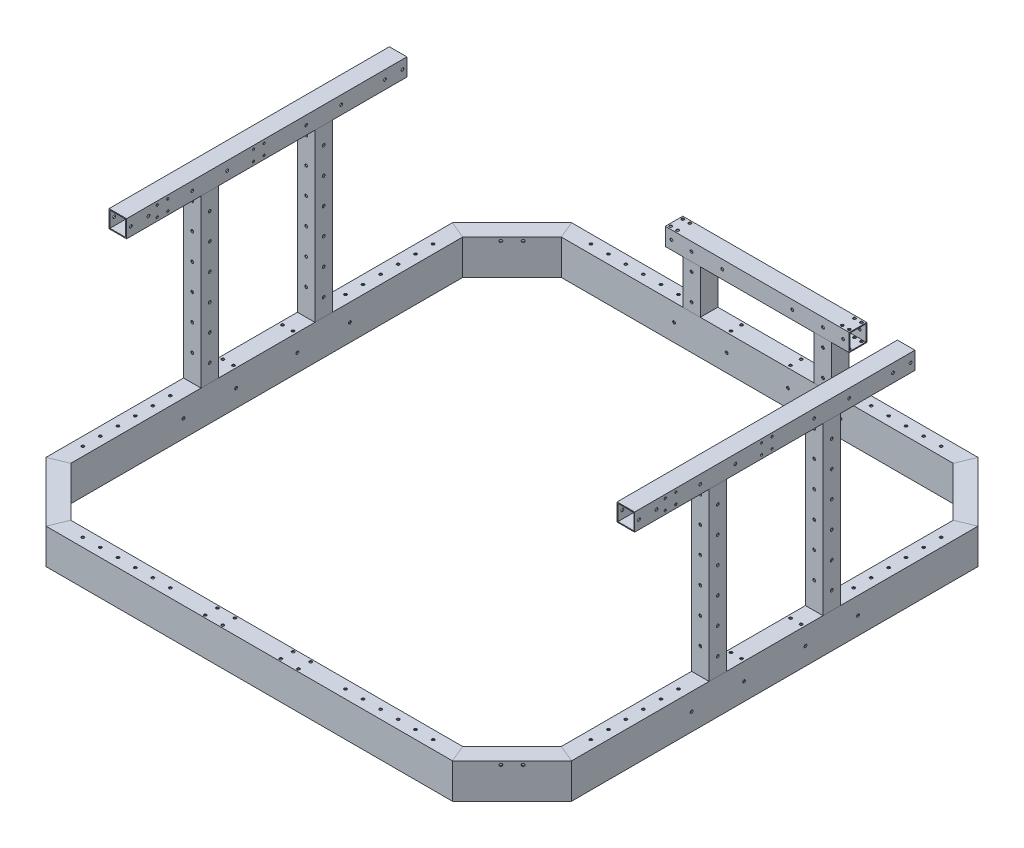
from build123d import *

# Parameters (mm, degrees)
F_20_X_20_X_2_1_DEPTH      = 465.977825579
F_20_X_20_X_2_1_DEPTH_BACK = 10.262096827
SKETCH1_W                  = 20
SKETCH1_H                  = 40
SKETCH1_W_2                = 18
SKETCH1_H_2                = 38
SKETCH1_ON_SEGMENT_2_W     = 20
SKETCH1_ON_SEGMENT_2_H     = 40
SKETCH1_ON_SEGMENT_2_W_2   = 18
SKETCH1_ON_SEGMENT_2_H_2   = 38
F_20_X_20_X_2_1_2_DEPTH    = 108.406444647
SKETCH1_ON_SEGMENT_3_W     = 20
SKETCH1_ON_SEGMENT_3_H     = 40
SKETCH1_ON_SEGMENT_3_W_2   = 18
SKETCH1_ON_SEGMENT_3_H_2   = 38
F_20_X_20_X_2_1_3_DEPTH    = 476.239922406
SKETCH1_ON_SEGMENT_4_W     = 20
SKETCH1_ON_SEGMENT_4_H     = 40
SKETCH1_ON_SEGMENT_4_W_2   = 18
SKETCH1_ON_SEGMENT_4_H_2   = 38
F_20_X_20_X_2_1_4_DEPTH    = 108.406444647
SKETCH1_ON_SEGMENT_5_W     = 20
SKETCH1_ON_SEGMENT_5_H     = 40
SKETCH1_ON_SEGMENT_5_W_2   = 18
SKETCH1_ON_SEGMENT_5_H_2   = 38
F_20_X_20_X_2_1_5_DEPTH    = 476.239922406
SKETCH1_ON_SEGMENT_6_W     = 20
SKETCH1_ON_SEGMENT_6_H     = 40
SKETCH1_ON_SEGMENT_6_W_2   = 18
SKETCH1_ON_SEGMENT_6_H_2   = 38
F_20_X_20_X_2_1_6_DEPTH    = 108.406444647
SKETCH1_ON_SEGMENT_7_W     = 20
SKETCH1_ON_SEGMENT_7_H     = 40
SKETCH1_ON_SEGMENT_7_W_2   = 18
SKETCH1_ON_SEGMENT_7_H_2   = 38
F_20_X_20_X_2_1_7_DEPTH    = 476.239922406
SKETCH1_ON_SEGMENT_8_W     = 20
SKETCH1_ON_SEGMENT_8_H     = 40
SKETCH1_ON_SEGMENT_8_W_2   = 18
SKETCH1_ON_SEGMENT_8_H_2   = 38
F_20_X_20_X_2_1_8_DEPTH    = 108.406444647
SKETCH_2_R                 = 1.6
CUT_EXTRUDE_1_DEPTH        = 427.145515059
SKETCH13_W                 = 20
SKETCH13_H                 = 20
SKETCH13_W_2               = 18
SKETCH13_H_2               = 18
F_20_X_20_X_2_4_DEPTH      = 61
SKETCH13_ON_SEGMENT_2_W    = 20
SKETCH13_ON_SEGMENT_2_H    = 20
SKETCH13_ON_SEGMENT_2_W_2  = 18
SKETCH13_ON_SEGMENT_2_H_2  = 18
F_20_X_20_X_2_4_2_DEPTH    = 61
SKETCH13_ON_SEGMENT_3_W    = 20
SKETCH13_ON_SEGMENT_3_H    = 20
SKETCH13_ON_SEGMENT_3_W_2  = 18
SKETCH13_ON_SEGMENT_3_H_2  = 18
F_20_X_20_X_2_4_3_DEPTH    = 210
CUT_EXTRUDE_3467_REACH     = 440.292
SKETCH_11_R                = 1.6
SKETCH15_W                 = 20
SKETCH15_H                 = 20
SKETCH15_W_2               = 18
SKETCH15_H_2               = 18
F_20_X_20_X_2_5_DEPTH      = 201
SKETCH15_ON_SEGMENT_2_W    = 20
SKETCH15_ON_SEGMENT_2_H    = 20
SKETCH15_ON_SEGMENT_2_W_2  = 18
SKETCH15_ON_SEGMENT_2_H_2  = 18
F_20_X_20_X_2_5_2_DEPTH    = 201
SKETCH15_ON_SEGMENT_3_W    = 20
SKETCH15_ON_SEGMENT_3_H    = 20
SKETCH15_ON_SEGMENT_3_W_2  = 18
SKETCH15_ON_SEGMENT_3_H_2  = 18
F_20_X_20_X_2_5_3_DEPTH    = 320
SKETCH_15_R                = 1.25
CUT_EXTRUDE_4769_DEPTH     = 710.154426065
SKETCH_16_R                = 1.6
CUT_EXTRUDE_5362_DEPTH     = 710.154426065
SKETCH_17_R                = 1.6
CUT_EXTRUDE_5799_DEPTH     = 710.154426065
SKETCH_19_R                = 1.6
CUT_EXTRUDE_1_2_DEPTH      = 710.154426065
SKETCH_20_R                = 1.6
CUT_EXTRUDE_2_DEPTH        = 533.470656474
SKETCH_21_R                = 1.6
CUT_EXTRUDE_7568_DEPTH     = 474.392015147
SKETCH_22_R                = 1.6
CUT_EXTRUDE_1_3_DEPTH      = 833.833716903
SKETCH_23_R                = 1.6
CUT_EXTRUDE_2_2_DEPTH      = 833.833716903
SKETCH_24_R                = 1.6
CUT_EXTRUDE_2_3_DEPTH      = 710.154426065
CUT_EXTRUDE_3_REACH        = 711.154
SKETCH_25_R                = 1.6
SKETCH_26_R                = 1.6
CUT_EXTRUDE_4_DEPTH        = 474.392015147
SKETCH_30_R                = 2.5
CUT_EXTRUDE_5_DEPTH        = 1


with BuildPart() as part:
    # Sketch1 → 方形管 20 X 20 X 2(1) (new, two sides: drawn at the far end of the back side and taken through both)
    with BuildSketch(Plane(origin=(-290, 0, 227.857864376), x_dir=(-1, 0, 0), z_dir=(0, 0, -1)).offset(-F_20_X_20_X_2_1_DEPTH_BACK)):
        Rectangle(SKETCH1_W, SKETCH1_H)
        Rectangle(SKETCH1_W_2, SKETCH1_H_2, mode=Mode.SUBTRACT)
    extrude(amount=F_20_X_20_X_2_1_DEPTH + F_20_X_20_X_2_1_DEPTH_BACK)

    # 方形管 20 X 20 X 2(1) mitre 1
    split(bisect_by=Plane(origin=(-290, 0, 227.857864376), x_dir=(0, 1, 0), z_dir=(-0.382683432, 0, -0.923879533)), keep=Keep.TOP)

    # 方形管 20 X 20 X 2(1) mitre 2
    split(bisect_by=Plane(origin=(-290, 0, -227.857864376), x_dir=(0, -1, 0), z_dir=(-0.382683432, 0, 0.923879533)), keep=Keep.TOP)


with BuildPart() as body_2:
    # Sketch1 on segment 2 (carried to segment 2) → 20 X 20 X 2_1 2 (new body)
    with BuildSketch(Plane(origin=(-297.256398255, 0, -220.601466121), x_dir=(-0.707106781, 0, -0.707106781), z_dir=(0.707106781, 0, -0.707106781))):
        Rectangle(SKETCH1_ON_SEGMENT_2_W, SKETCH1_ON_SEGMENT_2_H)
        Rectangle(SKETCH1_ON_SEGMENT_2_W_2, SKETCH1_ON_SEGMENT_2_H_2, mode=Mode.SUBTRACT)
    extrude(amount=F_20_X_20_X_2_1_2_DEPTH)

    # 20 X 20 X 2_1 2 mitre 1
    split(bisect_by=Plane(origin=(-227.857864376, 0, -290), x_dir=(0, -1, 0), z_dir=(-0.923879533, 0, 0.382683432)), keep=Keep.TOP)

    # 20 X 20 X 2_1 2 mitre 2
    split(bisect_by=Plane(origin=(-290, 0, -227.857864376), x_dir=(0, 1, 0), z_dir=(0.382683432, 0, -0.923879533)), keep=Keep.TOP)


with BuildPart() as body_3:
    # Sketch1 on segment 3 (carried to segment 3) → 20 X 20 X 2_1 3 (new body)
    with BuildSketch(Plane(origin=(-238.119961203, 0, -290), x_dir=(0, 0, -1), z_dir=(1, 0, 0))):
        Rectangle(SKETCH1_ON_SEGMENT_3_W, SKETCH1_ON_SEGMENT_3_H)
        Rectangle(SKETCH1_ON_SEGMENT_3_W_2, SKETCH1_ON_SEGMENT_3_H_2, mode=Mode.SUBTRACT)
    extrude(amount=F_20_X_20_X_2_1_3_DEPTH)

    # 20 X 20 X 2_1 3 mitre 1
    split(bisect_by=Plane(origin=(227.857864376, 0, -290), x_dir=(0, -1, 0), z_dir=(-0.923879533, 0, -0.382683432)), keep=Keep.TOP)

    # 20 X 20 X 2_1 3 mitre 2
    split(bisect_by=Plane(origin=(-227.857864376, 0, -290), x_dir=(0, 1, 0), z_dir=(0.923879533, 0, -0.382683432)), keep=Keep.TOP)


with BuildPart() as body_4:
    # Sketch1 on segment 4 (carried to segment 4) → 20 X 20 X 2_1 4 (new body)
    with BuildSketch(Plane(origin=(220.601466121, 0, -297.256398255), x_dir=(0.707106781, 0, -0.707106781), z_dir=(0.707106781, 0, 0.707106781))):
        Rectangle(SKETCH1_ON_SEGMENT_4_W, SKETCH1_ON_SEGMENT_4_H)
        Rectangle(SKETCH1_ON_SEGMENT_4_W_2, SKETCH1_ON_SEGMENT_4_H_2, mode=Mode.SUBTRACT)
    extrude(amount=F_20_X_20_X_2_1_4_DEPTH)

    # 20 X 20 X 2_1 4 mitre 1
    split(bisect_by=Plane(origin=(227.857864376, 0, -290), x_dir=(0, 1, 0), z_dir=(0.923879533, 0, 0.382683432)), keep=Keep.TOP)

    # 20 X 20 X 2_1 4 mitre 2
    split(bisect_by=Plane(origin=(290, 0, -227.857864376), x_dir=(0, 1, 0), z_dir=(-0.382683432, 0, -0.923879533)), keep=Keep.TOP)


with BuildPart() as body_5:
    # Sketch1 on segment 5 (carried to segment 5) → 20 X 20 X 2_1 5 (new body)
    with BuildSketch(Plane(origin=(290, 0, -238.119961203), x_dir=(1, 0, 0), z_dir=(0, 0, 1))):
        Rectangle(SKETCH1_ON_SEGMENT_5_W, SKETCH1_ON_SEGMENT_5_H)
        Rectangle(SKETCH1_ON_SEGMENT_5_W_2, SKETCH1_ON_SEGMENT_5_H_2, mode=Mode.SUBTRACT)
    extrude(amount=F_20_X_20_X_2_1_5_DEPTH)

    # 20 X 20 X 2_1 5 mitre 1
    split(bisect_by=Plane(origin=(290, 0, 227.857864376), x_dir=(0, 1, 0), z_dir=(0.382683432, 0, -0.923879533)), keep=Keep.TOP)

    # 20 X 20 X 2_1 5 mitre 2
    split(bisect_by=Plane(origin=(290, 0, -227.857864376), x_dir=(0, -1, 0), z_dir=(0.382683432, 0, 0.923879533)), keep=Keep.TOP)


with BuildPart() as body_6:
    # Sketch1 on segment 6 (carried to segment 6) → 20 X 20 X 2_1 6 (new body)
    with BuildSketch(Plane(origin=(297.256398255, 0, 220.601466121), x_dir=(0.707106781, 0, 0.707106781), z_dir=(-0.707106781, 0, 0.707106781))):
        Rectangle(SKETCH1_ON_SEGMENT_6_W, SKETCH1_ON_SEGMENT_6_H)
        Rectangle(SKETCH1_ON_SEGMENT_6_W_2, SKETCH1_ON_SEGMENT_6_H_2, mode=Mode.SUBTRACT)
    extrude(amount=F_20_X_20_X_2_1_6_DEPTH)

    # 20 X 20 X 2_1 6 mitre 1
    split(bisect_by=Plane(origin=(227.857864376, 0, 290), x_dir=(0, 1, 0), z_dir=(0.923879533, 0, -0.382683432)), keep=Keep.TOP)

    # 20 X 20 X 2_1 6 mitre 2
    split(bisect_by=Plane(origin=(290, 0, 227.857864376), x_dir=(0, -1, 0), z_dir=(-0.382683432, 0, 0.923879533)), keep=Keep.TOP)


with BuildPart() as body_7:
    # Sketch1 on segment 7 (carried to segment 7) → 20 X 20 X 2_1 7 (new body)
    with BuildSketch(Plane(origin=(238.119961203, 0, 290), x_dir=(0, 0, 1), z_dir=(-1, 0, 0))):
        Rectangle(SKETCH1_ON_SEGMENT_7_W, SKETCH1_ON_SEGMENT_7_H)
        Rectangle(SKETCH1_ON_SEGMENT_7_W_2, SKETCH1_ON_SEGMENT_7_H_2, mode=Mode.SUBTRACT)
    extrude(amount=F_20_X_20_X_2_1_7_DEPTH)

    # 20 X 20 X 2_1 7 mitre 1
    split(bisect_by=Plane(origin=(227.857864376, 0, 290), x_dir=(0, -1, 0), z_dir=(-0.923879533, 0, 0.382683432)), keep=Keep.TOP)

    # 20 X 20 X 2_1 7 mitre 2
    split(bisect_by=Plane(origin=(-227.857864376, 0, 290), x_dir=(0, 1, 0), z_dir=(0.923879533, 0, 0.382683432)), keep=Keep.TOP)


with BuildPart() as body_8:
    # Sketch1 on segment 8 (carried to segment 8) → 20 X 20 X 2_1 8 (new body)
    with BuildSketch(Plane(origin=(-220.601466121, 0, 297.256398255), x_dir=(-0.707106781, 0, 0.707106781), z_dir=(-0.707106781, 0, -0.707106781))):
        Rectangle(SKETCH1_ON_SEGMENT_8_W, SKETCH1_ON_SEGMENT_8_H)
        Rectangle(SKETCH1_ON_SEGMENT_8_W_2, SKETCH1_ON_SEGMENT_8_H_2, mode=Mode.SUBTRACT)
    extrude(amount=F_20_X_20_X_2_1_8_DEPTH)

    # 20 X 20 X 2_1 8 mitre 1
    split(bisect_by=Plane(origin=(-227.857864376, 0, 290), x_dir=(0, -1, 0), z_dir=(-0.923879533, 0, -0.382683432)), keep=Keep.TOP)

    # 20 X 20 X 2_1 8 mitre 2
    split(bisect_by=Plane(origin=(-290, 0, 227.857864376), x_dir=(0, -1, 0), z_dir=(0.382683432, 0, 0.923879533)), keep=Keep.TOP)


with BuildPart() as cut_extrude_1_tool:
    # 草图2 → Cut-Extrude 1 (new, through all)
    with BuildSketch(Plane(origin=(0, 20, 0), x_dir=(1, 0, 0), z_dir=(0, 1, 0))):
        with Locations(Location((-284, 34, 0), (0, 0, 270))):
            Circle(SKETCH_2_R)
        with Locations(Location((-296, 34, 0), (0, 0, 270))):
            Circle(SKETCH_2_R)
        with Locations(Location((-284, -34, 0), (0, 0, 270))):
            Circle(SKETCH_2_R)
        with Locations(Location((-296, -34, 0), (0, 0, 270))):
            Circle(SKETCH_2_R)
        with Locations(Location((34, 296, 0), (0, 0, 270))):
            Circle(SKETCH_2_R)
        with Locations(Location((34, 284, 0), (0, 0, 270))):
            Circle(SKETCH_2_R)
        with Locations(Location((-34, 296, 0), (0, 0, 270))):
            Circle(SKETCH_2_R)
        with Locations(Location((-34, 284, 0), (0, 0, 270))):
            Circle(SKETCH_2_R)
        with Locations(Location((296, -34, 0), (0, 0, 270))):
            Circle(SKETCH_2_R)
        with Locations(Location((284, -34, 0), (0, 0, 270))):
            Circle(SKETCH_2_R)
        with Locations(Location((296, 34, 0), (0, 0, 270))):
            Circle(SKETCH_2_R)
        with Locations(Location((284, 34, 0), (0, 0, 270))):
            Circle(SKETCH_2_R)
        with Locations(Location((33.2, -283, 0), (0, 0, 270))):
            Circle(SKETCH_2_R)
        with Locations(Location((53.2, -283, 0), (0, 0, 270))):
            Circle(SKETCH_2_R)
        with Locations(Location((53.2, -297, 0), (0, 0, 270))):
            Circle(SKETCH_2_R)
        with Locations(Location((33.2, -297, 0), (0, 0, 270))):
            Circle(SKETCH_2_R)
        with Locations(Location((-53.2, -297, 0), (0, 0, 270))):
            Circle(SKETCH_2_R)
        with Locations(Location((-53.2, -283, 0), (0, 0, 270))):
            Circle(SKETCH_2_R)
        with Locations(Location((-33.2, -283, 0), (0, 0, 270))):
            Circle(SKETCH_2_R)
        with Locations(Location((-33.2, -297, 0), (0, 0, 270))):
            Circle(SKETCH_2_R)
    extrude(amount=-CUT_EXTRUDE_1_DEPTH)


with BuildPart() as part_1:
    add(part.part)

    # Cut-Extrude 1: cut by cut_extrude_1_tool
    add(cut_extrude_1_tool.part, mode=Mode.SUBTRACT)


with BuildPart() as body_3_1:
    add(body_3.part)

    # Cut-Extrude 1: cut by cut_extrude_1_tool
    add(cut_extrude_1_tool.part, mode=Mode.SUBTRACT)

    # 切除-拉伸3: up to this face of the body (flat: up to its plane)
    cut_extrude_3_end = Plane(body_3_1.part.faces().sort_by_distance((0, 0, -280))[0])
    # 草图25 → 切除-拉伸3 (cut, up to the picked face)
    with BuildSketch(Plane(origin=(0, 0, -300), x_dir=(-1, 0, 0), z_dir=(0, 0, -1)), mode=Mode.PRIVATE) as cut_extrude_3_sk1:
        with Locations((-95, 0)):
            Circle(SKETCH_25_R)
    cut_extrude_3_tool1 = split(extrude(cut_extrude_3_sk1.sketch, amount=-CUT_EXTRUDE_3_REACH, mode=Mode.PRIVATE), bisect_by=cut_extrude_3_end, keep=Keep.BOTH, mode=Mode.PRIVATE)
    # 草图25 → 切除-拉伸3 (cut, up to the picked face)
    with BuildSketch(Plane(origin=(0, 0, -300), x_dir=(-1, 0, 0), z_dir=(0, 0, -1)), mode=Mode.PRIVATE) as cut_extrude_3_sk2:
        with Locations((-35, 0)):
            Circle(SKETCH_25_R)
    cut_extrude_3_tool2 = split(extrude(cut_extrude_3_sk2.sketch, amount=-CUT_EXTRUDE_3_REACH, mode=Mode.PRIVATE), bisect_by=cut_extrude_3_end, keep=Keep.BOTH, mode=Mode.PRIVATE)
    # 草图25 → 切除-拉伸3 (cut, up to the picked face)
    with BuildSketch(Plane(origin=(0, 0, -300), x_dir=(-1, 0, 0), z_dir=(0, 0, -1)), mode=Mode.PRIVATE) as cut_extrude_3_sk3:
        with Locations((35, 0)):
            Circle(SKETCH_25_R)
    cut_extrude_3_tool3 = split(extrude(cut_extrude_3_sk3.sketch, amount=-CUT_EXTRUDE_3_REACH, mode=Mode.PRIVATE), bisect_by=cut_extrude_3_end, keep=Keep.BOTH, mode=Mode.PRIVATE)
    # 草图25 → 切除-拉伸3 (cut, up to the picked face)
    with BuildSketch(Plane(origin=(0, 0, -300), x_dir=(-1, 0, 0), z_dir=(0, 0, -1)), mode=Mode.PRIVATE) as cut_extrude_3_sk4:
        with Locations((95, 0)):
            Circle(SKETCH_25_R)
    cut_extrude_3_tool4 = split(extrude(cut_extrude_3_sk4.sketch, amount=-CUT_EXTRUDE_3_REACH, mode=Mode.PRIVATE), bisect_by=cut_extrude_3_end, keep=Keep.BOTH, mode=Mode.PRIVATE)
    add(cut_extrude_3_tool1.solids().sort_by(Axis((95, 0, -300), (0, 0, 1)))[0], mode=Mode.SUBTRACT)
    add(cut_extrude_3_tool2.solids().sort_by(Axis((35, 0, -300), (0, 0, 1)))[0], mode=Mode.SUBTRACT)
    add(cut_extrude_3_tool3.solids().sort_by(Axis((-35, 0, -300), (0, 0, 1)))[0], mode=Mode.SUBTRACT)
    add(cut_extrude_3_tool4.solids().sort_by(Axis((-95, 0, -300), (0, 0, 1)))[0], mode=Mode.SUBTRACT)


with BuildPart() as body_5_1:
    add(body_5.part)

    # Cut-Extrude 1: cut by cut_extrude_1_tool
    add(cut_extrude_1_tool.part, mode=Mode.SUBTRACT)


with BuildPart() as body_7_1:
    add(body_7.part)

    # Cut-Extrude 1: cut by cut_extrude_1_tool
    add(cut_extrude_1_tool.part, mode=Mode.SUBTRACT)


with BuildPart() as body_9:
    # Sketch13 → 方形管 20 X 20 X 2(4) (new body)
    with BuildSketch(Plane(origin=(75, 20, -290), x_dir=(1, 0, 0), z_dir=(0, 1, 0))):
        Rectangle(SKETCH13_W, SKETCH13_H)
        Rectangle(SKETCH13_W_2, SKETCH13_H_2, mode=Mode.SUBTRACT)
    extrude(amount=F_20_X_20_X_2_4_DEPTH)

    # 方形管 20 X 20 X 2(4) end butt 1
    split(bisect_by=Plane(origin=(75, 70, -290), x_dir=(1, 0, 0), z_dir=(0, -1, 0)), keep=Keep.TOP)


with BuildPart() as body_10:
    # Sketch13 on segment 2 (carried to segment 2) → 20 X 20 X 2_4 2 (new body)
    with BuildSketch(Plane(origin=(-75, 20, -290), x_dir=(1, 0, 0), z_dir=(0, 1, 0))):
        Rectangle(SKETCH13_ON_SEGMENT_2_W, SKETCH13_ON_SEGMENT_2_H)
        Rectangle(SKETCH13_ON_SEGMENT_2_W_2, SKETCH13_ON_SEGMENT_2_H_2, mode=Mode.SUBTRACT)
    extrude(amount=F_20_X_20_X_2_4_2_DEPTH)

    # 20 X 20 X 2_4 2 end butt 1
    split(bisect_by=Plane(origin=(-75, 70, -290), x_dir=(1, 0, 0), z_dir=(0, -1, 0)), keep=Keep.TOP)


with BuildPart() as body_11:
    # Sketch13 on segment 3 (carried to segment 3) → 20 X 20 X 2_4 3 (new body)
    with BuildSketch(Plane(origin=(105, 80, -290), x_dir=(0, 1, 0), z_dir=(-1, 0, 0))):
        Rectangle(SKETCH13_ON_SEGMENT_3_W, SKETCH13_ON_SEGMENT_3_H)
        Rectangle(SKETCH13_ON_SEGMENT_3_W_2, SKETCH13_ON_SEGMENT_3_H_2, mode=Mode.SUBTRACT)
    extrude(amount=F_20_X_20_X_2_4_3_DEPTH)

    # Cut-Extrude 3467: up to this face of the body (flat: up to its plane)
    cut_extrude_3467_end = Plane(body_11.part.faces().sort_by_distance((0, 70, -290))[0])
    # 草图11 → Cut-Extrude 3467 (cut, up to the picked face)
    with BuildSketch(Plane(origin=(0, 90, 0), x_dir=(1, 0, 0), z_dir=(0, 1, 0)), mode=Mode.PRIVATE) as cut_extrude_3467_sk1:
        with Locations(Location((102, 283, 0), (0, 0, 180))):
            Circle(SKETCH_11_R)
    cut_extrude_3467_tool1 = split(extrude(cut_extrude_3467_sk1.sketch, amount=-CUT_EXTRUDE_3467_REACH, mode=Mode.PRIVATE), bisect_by=cut_extrude_3467_end, keep=Keep.BOTH, mode=Mode.PRIVATE)
    # 草图11 → Cut-Extrude 3467 (cut, up to the picked face)
    with BuildSketch(Plane(origin=(0, 90, 0), x_dir=(1, 0, 0), z_dir=(0, 1, 0)), mode=Mode.PRIVATE) as cut_extrude_3467_sk2:
        with Locations(Location((94, 283, 0), (0, 0, 180))):
            Circle(SKETCH_11_R)
    cut_extrude_3467_tool2 = split(extrude(cut_extrude_3467_sk2.sketch, amount=-CUT_EXTRUDE_3467_REACH, mode=Mode.PRIVATE), bisect_by=cut_extrude_3467_end, keep=Keep.BOTH, mode=Mode.PRIVATE)
    # 草图11 → Cut-Extrude 3467 (cut, up to the picked face)
    with BuildSketch(Plane(origin=(0, 90, 0), x_dir=(1, 0, 0), z_dir=(0, 1, 0)), mode=Mode.PRIVATE) as cut_extrude_3467_sk3:
        with Locations((94, 297)):
            Circle(SKETCH_11_R)
    cut_extrude_3467_tool3 = split(extrude(cut_extrude_3467_sk3.sketch, amount=-CUT_EXTRUDE_3467_REACH, mode=Mode.PRIVATE), bisect_by=cut_extrude_3467_end, keep=Keep.BOTH, mode=Mode.PRIVATE)
    # 草图11 → Cut-Extrude 3467 (cut, up to the picked face)
    with BuildSketch(Plane(origin=(0, 90, 0), x_dir=(1, 0, 0), z_dir=(0, 1, 0)), mode=Mode.PRIVATE) as cut_extrude_3467_sk4:
        with Locations((102, 297)):
            Circle(SKETCH_11_R)
    cut_extrude_3467_tool4 = split(extrude(cut_extrude_3467_sk4.sketch, amount=-CUT_EXTRUDE_3467_REACH, mode=Mode.PRIVATE), bisect_by=cut_extrude_3467_end, keep=Keep.BOTH, mode=Mode.PRIVATE)
    # 草图11 → Cut-Extrude 3467 (cut, up to the picked face)
    with BuildSketch(Plane(origin=(0, 90, 0), x_dir=(1, 0, 0), z_dir=(0, 1, 0)), mode=Mode.PRIVATE) as cut_extrude_3467_sk5:
        with Locations(Location((-94, 297, 0), (0, 0, 180))):
            Circle(SKETCH_11_R)
    cut_extrude_3467_tool5 = split(extrude(cut_extrude_3467_sk5.sketch, amount=-CUT_EXTRUDE_3467_REACH, mode=Mode.PRIVATE), bisect_by=cut_extrude_3467_end, keep=Keep.BOTH, mode=Mode.PRIVATE)
    # 草图11 → Cut-Extrude 3467 (cut, up to the picked face)
    with BuildSketch(Plane(origin=(0, 90, 0), x_dir=(1, 0, 0), z_dir=(0, 1, 0)), mode=Mode.PRIVATE) as cut_extrude_3467_sk6:
        with Locations(Location((-102, 297, 0), (0, 0, 180))):
            Circle(SKETCH_11_R)
    cut_extrude_3467_tool6 = split(extrude(cut_extrude_3467_sk6.sketch, amount=-CUT_EXTRUDE_3467_REACH, mode=Mode.PRIVATE), bisect_by=cut_extrude_3467_end, keep=Keep.BOTH, mode=Mode.PRIVATE)
    # 草图11 → Cut-Extrude 3467 (cut, up to the picked face)
    with BuildSketch(Plane(origin=(0, 90, 0), x_dir=(1, 0, 0), z_dir=(0, 1, 0)), mode=Mode.PRIVATE) as cut_extrude_3467_sk7:
        with Locations((-94, 283)):
            Circle(SKETCH_11_R)
    cut_extrude_3467_tool7 = split(extrude(cut_extrude_3467_sk7.sketch, amount=-CUT_EXTRUDE_3467_REACH, mode=Mode.PRIVATE), bisect_by=cut_extrude_3467_end, keep=Keep.BOTH, mode=Mode.PRIVATE)
    # 草图11 → Cut-Extrude 3467 (cut, up to the picked face)
    with BuildSketch(Plane(origin=(0, 90, 0), x_dir=(1, 0, 0), z_dir=(0, 1, 0)), mode=Mode.PRIVATE) as cut_extrude_3467_sk8:
        with Locations((-102, 283)):
            Circle(SKETCH_11_R)
    cut_extrude_3467_tool8 = split(extrude(cut_extrude_3467_sk8.sketch, amount=-CUT_EXTRUDE_3467_REACH, mode=Mode.PRIVATE), bisect_by=cut_extrude_3467_end, keep=Keep.BOTH, mode=Mode.PRIVATE)
    add(cut_extrude_3467_tool1.solids().sort_by(Axis((102, 90, -283), (0, -1, 0)))[0], mode=Mode.SUBTRACT)
    add(cut_extrude_3467_tool2.solids().sort_by(Axis((94, 90, -283), (0, -1, 0)))[0], mode=Mode.SUBTRACT)
    add(cut_extrude_3467_tool3.solids().sort_by(Axis((94, 90, -297), (0, -1, 0)))[0], mode=Mode.SUBTRACT)
    add(cut_extrude_3467_tool4.solids().sort_by(Axis((102, 90, -297), (0, -1, 0)))[0], mode=Mode.SUBTRACT)
    add(cut_extrude_3467_tool5.solids().sort_by(Axis((-94, 90, -297), (0, -1, 0)))[0], mode=Mode.SUBTRACT)
    add(cut_extrude_3467_tool6.solids().sort_by(Axis((-102, 90, -297), (0, -1, 0)))[0], mode=Mode.SUBTRACT)
    add(cut_extrude_3467_tool7.solids().sort_by(Axis((-94, 90, -283), (0, -1, 0)))[0], mode=Mode.SUBTRACT)
    add(cut_extrude_3467_tool8.solids().sort_by(Axis((-102, 90, -283), (0, -1, 0)))[0], mode=Mode.SUBTRACT)


with BuildPart() as body_12:
    # Sketch15 → 方形管 20 X 20 X 2(5) (new body)
    with BuildSketch(Plane(origin=(290, 20, 65), x_dir=(0, 0, 1), z_dir=(0, 1, 0))):
        Rectangle(SKETCH15_W, SKETCH15_H)
        Rectangle(SKETCH15_W_2, SKETCH15_H_2, mode=Mode.SUBTRACT)
    extrude(amount=F_20_X_20_X_2_5_DEPTH)

    # 方形管 20 X 20 X 2(5) end butt 1
    split(bisect_by=Plane(origin=(290, 210, 65), x_dir=(1, 0, 0), z_dir=(0, -1, 0)), keep=Keep.TOP)


with BuildPart() as body_13:
    # Sketch15 on segment 2 (carried to segment 2) → 20 X 20 X 2_5 2 (new body)
    with BuildSketch(Plane(origin=(290, 20, -65), x_dir=(0, 0, 1), z_dir=(0, 1, 0))):
        Rectangle(SKETCH15_ON_SEGMENT_2_W, SKETCH15_ON_SEGMENT_2_H)
        Rectangle(SKETCH15_ON_SEGMENT_2_W_2, SKETCH15_ON_SEGMENT_2_H_2, mode=Mode.SUBTRACT)
    extrude(amount=F_20_X_20_X_2_5_2_DEPTH)

    # 20 X 20 X 2_5 2 end butt 1
    split(bisect_by=Plane(origin=(290, 210, -65), x_dir=(1, 0, 0), z_dir=(0, -1, 0)), keep=Keep.TOP)


with BuildPart() as body_14:
    # Sketch15 on segment 3 (carried to segment 3) → 20 X 20 X 2_5 3 (new body)
    with BuildSketch(Plane(origin=(290, 220, 160), x_dir=(0, 1, 0), z_dir=(0, 0, -1))):
        Rectangle(SKETCH15_ON_SEGMENT_3_W, SKETCH15_ON_SEGMENT_3_H)
        Rectangle(SKETCH15_ON_SEGMENT_3_W_2, SKETCH15_ON_SEGMENT_3_H_2, mode=Mode.SUBTRACT)
    extrude(amount=F_20_X_20_X_2_5_3_DEPTH)

    # 草图15 → Cut-Extrude 4769 (cut, through all)
    with BuildSketch(Plane(origin=(300, 0, 0), x_dir=(0, 0, -1), z_dir=(1, 0, 0))):
        with Locations((-3, 226)):
            Circle(SKETCH_15_R)
        with Locations((-15, 226)):
            Circle(SKETCH_15_R)
        with Locations(Location((-3, 214, 0), (0, 0, 180))):
            Circle(SKETCH_15_R)
        with Locations(Location((-15, 214, 0), (0, 0, 180))):
            Circle(SKETCH_15_R)
        with Locations((-125, 226)):
            Circle(SKETCH_15_R)
        with Locations((-113, 226)):
            Circle(SKETCH_15_R)
        with Locations(Location((-113, 214, 0), (0, 0, 180))):
            Circle(SKETCH_15_R)
        with Locations(Location((-125, 214, 0), (0, 0, 180))):
            Circle(SKETCH_15_R)
    extrude(amount=-CUT_EXTRUDE_4769_DEPTH, mode=Mode.SUBTRACT)


with BuildPart() as body_15:
    # 镜向2: mirrored copy
    add(body_13.part.mirror(Plane(origin=(0, 0, 0), x_dir=(0, 0, 1), z_dir=(1, 0, 0))))


with BuildPart() as body_16:
    # Mirror 2 2: mirrored copy
    add(body_12.part.mirror(Plane(origin=(0, 0, 0), x_dir=(0, 0, 1), z_dir=(1, 0, 0))))


with BuildPart() as body_17:
    # Mirror 2 3: mirrored copy
    add(body_14.part.mirror(Plane(origin=(0, 0, 0), x_dir=(0, 0, 1), z_dir=(1, 0, 0))))


with BuildPart() as cut_extrude_5362_tool:
    # 草图16 → Cut-Extrude 5362 (new, through all)
    with BuildSketch(Plane.ZY.offset(300)):
        with Locations((135, 220)):
            Circle(SKETCH_16_R)
        with Locations((155, 220)):
            Circle(SKETCH_16_R)
        with Locations(Location((-155, 220, 0), (0, 0, 180))):
            Circle(SKETCH_16_R)
        with Locations(Location((-135, 220, 0), (0, 0, 180))):
            Circle(SKETCH_16_R)
    extrude(amount=-CUT_EXTRUDE_5362_DEPTH)


with BuildPart() as body_14_1:
    add(body_14.part)

    # Cut-Extrude 5362: cut by cut_extrude_5362_tool
    add(cut_extrude_5362_tool.part, mode=Mode.SUBTRACT)


with BuildPart() as body_17_1:
    add(body_17.part)

    # Cut-Extrude 5362: cut by cut_extrude_5362_tool
    add(cut_extrude_5362_tool.part, mode=Mode.SUBTRACT)


with BuildPart() as cut_extrude_5799_tool:
    # 草图17 → Cut-Extrude 5799 (new, through all)
    with BuildSketch(Plane(origin=(0, 0, -300), x_dir=(-1, 0, 0), z_dir=(0, 0, -1))):
        with Locations(Location((-98, 80, 0), (0, 0, 90))):
            Circle(SKETCH_17_R)
        with Locations(Location((-75, 80, 0), (0, 0, 90))):
            Circle(SKETCH_17_R)
        with Locations(Location((-75, 60, 0), (0, 0, 90))):
            Circle(SKETCH_17_R)
        with Locations(Location((-75, 30, 0), (0, 0, 90))):
            Circle(SKETCH_17_R)
        with Locations(Location((75, 30, 0), (0, 0, 180))):
            Circle(SKETCH_17_R)
        with Locations(Location((75, 60, 0), (0, 0, 180))):
            Circle(SKETCH_17_R)
        with Locations(Location((75, 80, 0), (0, 0, 270))):
            Circle(SKETCH_17_R)
        with Locations(Location((98, 80, 0), (0, 0, 270))):
            Circle(SKETCH_17_R)
        with Locations(Location((-40, 80, 0), (0, 0, 90))):
            Circle(SKETCH_17_R)
        with Locations(Location((40, 80, 0), (0, 0, 270))):
            Circle(SKETCH_17_R)
    extrude(amount=-CUT_EXTRUDE_5799_DEPTH)


with BuildPart() as body_9_1:
    add(body_9.part)

    # Cut-Extrude 5799: cut by cut_extrude_5799_tool
    add(cut_extrude_5799_tool.part, mode=Mode.SUBTRACT)


with BuildPart() as body_10_1:
    add(body_10.part)

    # Cut-Extrude 5799: cut by cut_extrude_5799_tool
    add(cut_extrude_5799_tool.part, mode=Mode.SUBTRACT)


with BuildPart() as body_11_1:
    add(body_11.part)

    # Cut-Extrude 5799: cut by cut_extrude_5799_tool
    add(cut_extrude_5799_tool.part, mode=Mode.SUBTRACT)


with BuildPart() as cut_extrude_1_2_tool:
    # 草图19 → Cut-Extrude 1 2 (new, through all)
    with BuildSketch(Plane(origin=(300, 0, 0), x_dir=(0, 0, -1), z_dir=(1, 0, 0))):
        with Locations((45, 220)):
            Circle(SKETCH_19_R)
        with Locations((85, 220)):
            Circle(SKETCH_19_R)
        with Locations((65, 190)):
            Circle(SKETCH_19_R)
        with Locations((65, 160)):
            Circle(SKETCH_19_R)
        with Locations((65, 130)):
            Circle(SKETCH_19_R)
        with Locations((65, 100)):
            Circle(SKETCH_19_R)
        with Locations((65, 70)):
            Circle(SKETCH_19_R)
        with Locations((-65, 70)):
            Circle(SKETCH_19_R)
        with Locations((-65, 100)):
            Circle(SKETCH_19_R)
        with Locations((-65, 130)):
            Circle(SKETCH_19_R)
        with Locations((-65, 160)):
            Circle(SKETCH_19_R)
        with Locations((-65, 190)):
            Circle(SKETCH_19_R)
        with Locations((-85, 220)):
            Circle(SKETCH_19_R)
        with Locations((-45, 220)):
            Circle(SKETCH_19_R)
        with Locations((65, 40)):
            Circle(SKETCH_19_R)
        with Locations((-65, 40)):
            Circle(SKETCH_19_R)
    extrude(amount=-CUT_EXTRUDE_1_2_DEPTH)


with BuildPart() as body_12_1:
    add(body_12.part)

    # Cut-Extrude 1 2: cut by cut_extrude_1_2_tool
    add(cut_extrude_1_2_tool.part, mode=Mode.SUBTRACT)


with BuildPart() as body_13_1:
    add(body_13.part)

    # Cut-Extrude 1 2: cut by cut_extrude_1_2_tool
    add(cut_extrude_1_2_tool.part, mode=Mode.SUBTRACT)


with BuildPart() as body_14_2:
    add(body_14_1.part)

    # Cut-Extrude 1 2: cut by cut_extrude_1_2_tool
    add(cut_extrude_1_2_tool.part, mode=Mode.SUBTRACT)


with BuildPart() as body_15_1:
    add(body_15.part)

    # Cut-Extrude 1 2: cut by cut_extrude_1_2_tool
    add(cut_extrude_1_2_tool.part, mode=Mode.SUBTRACT)


with BuildPart() as body_16_1:
    add(body_16.part)

    # Cut-Extrude 1 2: cut by cut_extrude_1_2_tool
    add(cut_extrude_1_2_tool.part, mode=Mode.SUBTRACT)


with BuildPart() as body_17_2:
    add(body_17_1.part)

    # Cut-Extrude 1 2: cut by cut_extrude_1_2_tool
    add(cut_extrude_1_2_tool.part, mode=Mode.SUBTRACT)


with BuildPart() as cut_extrude_2_tool:
    # 草图20 → Cut-Extrude 2 (new, through all)
    with BuildSketch(Plane(origin=(0, 0, -75), x_dir=(-1, 0, 0), z_dir=(0, 0, -1))):
        with Locations((-290, 200)):
            Circle(SKETCH_20_R)
        with Locations((-290, 170)):
            Circle(SKETCH_20_R)
        with Locations((-290, 140)):
            Circle(SKETCH_20_R)
        with Locations((-290, 110)):
            Circle(SKETCH_20_R)
        with Locations((-290, 80)):
            Circle(SKETCH_20_R)
        with Locations((290, 80)):
            Circle(SKETCH_20_R)
        with Locations((290, 110)):
            Circle(SKETCH_20_R)
        with Locations((290, 140)):
            Circle(SKETCH_20_R)
        with Locations((290, 170)):
            Circle(SKETCH_20_R)
        with Locations((290, 200)):
            Circle(SKETCH_20_R)
        with Locations((-290, 50)):
            Circle(SKETCH_20_R)
        with Locations((290, 50)):
            Circle(SKETCH_20_R)
    extrude(amount=-CUT_EXTRUDE_2_DEPTH)


with BuildPart() as body_12_2:
    add(body_12_1.part)

    # Cut-Extrude 2: cut by cut_extrude_2_tool
    add(cut_extrude_2_tool.part, mode=Mode.SUBTRACT)


with BuildPart() as body_13_2:
    add(body_13_1.part)

    # Cut-Extrude 2: cut by cut_extrude_2_tool
    add(cut_extrude_2_tool.part, mode=Mode.SUBTRACT)


with BuildPart() as body_15_2:
    add(body_15_1.part)

    # Cut-Extrude 2: cut by cut_extrude_2_tool
    add(cut_extrude_2_tool.part, mode=Mode.SUBTRACT)


with BuildPart() as body_16_2:
    add(body_16_1.part)

    # Cut-Extrude 2: cut by cut_extrude_2_tool
    add(cut_extrude_2_tool.part, mode=Mode.SUBTRACT)


with BuildPart() as cut_extrude_7568_tool:
    # 草图21 → Cut-Extrude 7568 (new, through all)
    with BuildSketch(Plane(origin=(0, 20, 0), x_dir=(1, 0, 0), z_dir=(0, 1, 0))):
        with Locations(Location((290, -200, 0), (0, 0, 180))):
            Circle(SKETCH_21_R)
        with Locations(Location((290, -180, 0), (0, 0, 180))):
            Circle(SKETCH_21_R)
        with Locations(Location((290, -160, 0), (0, 0, 180))):
            Circle(SKETCH_21_R)
        with Locations(Location((290, -140, 0), (0, 0, 180))):
            Circle(SKETCH_21_R)
        with Locations(Location((290, 140, 0), (0, 0, 180))):
            Circle(SKETCH_21_R)
        with Locations(Location((290, 160, 0), (0, 0, 180))):
            Circle(SKETCH_21_R)
        with Locations(Location((290, 180, 0), (0, 0, 180))):
            Circle(SKETCH_21_R)
        with Locations(Location((290, 200, 0), (0, 0, 180))):
            Circle(SKETCH_21_R)
        with Locations(Location((-290, -140, 0), (0, 0, 180))):
            Circle(SKETCH_21_R)
        with Locations(Location((-290, -160, 0), (0, 0, 180))):
            Circle(SKETCH_21_R)
        with Locations(Location((-290, -180, 0), (0, 0, 180))):
            Circle(SKETCH_21_R)
        with Locations(Location((-290, -200, 0), (0, 0, 180))):
            Circle(SKETCH_21_R)
        with Locations(Location((-290, 200, 0), (0, 0, 180))):
            Circle(SKETCH_21_R)
        with Locations(Location((-290, 180, 0), (0, 0, 180))):
            Circle(SKETCH_21_R)
        with Locations(Location((-290, 160, 0), (0, 0, 180))):
            Circle(SKETCH_21_R)
        with Locations(Location((-290, 140, 0), (0, 0, 180))):
            Circle(SKETCH_21_R)
        with Locations(Location((290, -120, 0), (0, 0, 180))):
            Circle(SKETCH_21_R)
        with Locations(Location((290, -100, 0), (0, 0, 180))):
            Circle(SKETCH_21_R)
        with Locations(Location((290, 100, 0), (0, 0, 180))):
            Circle(SKETCH_21_R)
        with Locations(Location((290, 120, 0), (0, 0, 180))):
            Circle(SKETCH_21_R)
        with Locations(Location((-290, 120, 0), (0, 0, 180))):
            Circle(SKETCH_21_R)
        with Locations(Location((-290, 100, 0), (0, 0, 180))):
            Circle(SKETCH_21_R)
        with Locations(Location((-290, -100, 0), (0, 0, 180))):
            Circle(SKETCH_21_R)
        with Locations(Location((-290, -120, 0), (0, 0, 180))):
            Circle(SKETCH_21_R)
    extrude(amount=-CUT_EXTRUDE_7568_DEPTH)


with BuildPart() as part_2:
    add(part_1.part)

    # Cut-Extrude 7568: cut by cut_extrude_7568_tool
    add(cut_extrude_7568_tool.part, mode=Mode.SUBTRACT)


with BuildPart() as body_5_2:
    add(body_5_1.part)

    # Cut-Extrude 7568: cut by cut_extrude_7568_tool
    add(cut_extrude_7568_tool.part, mode=Mode.SUBTRACT)


with BuildPart() as cut_extrude_1_3_tool:
    # 草图22 → Cut-Extrude 1 3 (new, through all)
    with BuildSketch(Plane(origin=(266, 0, -266), x_dir=(-0.7071067811865495, 0, -0.7071067811865457), z_dir=(0.7071067811865457, 0, -0.7071067811865495))):
        with Locations(Location((-9, 16, 0), (0, 0, 180))):
            Circle(SKETCH_22_R)
        with Locations(Location((9, 16, 0), (0, 0, 180))):
            Circle(SKETCH_22_R)
    extrude(amount=-CUT_EXTRUDE_1_3_DEPTH)


with BuildPart() as body_4_1:
    add(body_4.part)

    # Cut-Extrude 1 3: cut by cut_extrude_1_3_tool
    add(cut_extrude_1_3_tool.part, mode=Mode.SUBTRACT)


with BuildPart() as body_8_1:
    add(body_8.part)

    # Cut-Extrude 1 3: cut by cut_extrude_1_3_tool
    add(cut_extrude_1_3_tool.part, mode=Mode.SUBTRACT)


with BuildPart() as cut_extrude_2_2_tool:
    # 草图23 → Cut-Extrude 2 2 (new, through all)
    with BuildSketch(Plane(origin=(266, 0, 266), x_dir=(0.7071067811865495, 0, -0.7071067811865457), z_dir=(0.7071067811865457, 0, 0.7071067811865495))):
        with Locations(Location((-9, 16, 0), (0, 0, 180))):
            Circle(SKETCH_23_R)
        with Locations(Location((9, 16, 0), (0, 0, 180))):
            Circle(SKETCH_23_R)
    extrude(amount=-CUT_EXTRUDE_2_2_DEPTH)


with BuildPart() as body_2_1:
    add(body_2.part)

    # Cut-Extrude 2 2: cut by cut_extrude_2_2_tool
    add(cut_extrude_2_2_tool.part, mode=Mode.SUBTRACT)


with BuildPart() as body_6_1:
    add(body_6.part)

    # Cut-Extrude 2 2: cut by cut_extrude_2_2_tool
    add(cut_extrude_2_2_tool.part, mode=Mode.SUBTRACT)


with BuildPart() as cut_extrude_2_3_tool:
    # 草图24 → Cut-Extrude 2 3 (new, through all)
    with BuildSketch(Plane(origin=(300, 0, 0), x_dir=(0, 0, -1), z_dir=(1, 0, 0))):
        with Locations(Location((-95, 0, 0), (0, 0, 180))):
            Circle(SKETCH_24_R)
        with Locations(Location((-35, 0, 0), (0, 0, 180))):
            Circle(SKETCH_24_R)
        with Locations(Location((35, 0, 0), (0, 0, 180))):
            Circle(SKETCH_24_R)
        with Locations(Location((95, 0, 0), (0, 0, 180))):
            Circle(SKETCH_24_R)
    extrude(amount=-CUT_EXTRUDE_2_3_DEPTH)


with BuildPart() as part_3:
    add(part_2.part)

    # Cut-Extrude 2 3: cut by cut_extrude_2_3_tool
    add(cut_extrude_2_3_tool.part, mode=Mode.SUBTRACT)


with BuildPart() as body_5_3:
    add(body_5_2.part)

    # Cut-Extrude 2 3: cut by cut_extrude_2_3_tool
    add(cut_extrude_2_3_tool.part, mode=Mode.SUBTRACT)


with BuildPart() as cut_extrude_4_tool:
    # 草图26 → 切除-拉伸4 (new, through all)
    with BuildSketch(Plane(origin=(0, 20, 0), x_dir=(1, 0, 0), z_dir=(0, 1, 0))):
        with Locations(Location((200, 290, 0), (0, 0, 270))):
            Circle(SKETCH_26_R)
        with Locations(Location((180, 290, 0), (0, 0, 270))):
            Circle(SKETCH_26_R)
        with Locations(Location((160, 290, 0), (0, 0, 270))):
            Circle(SKETCH_26_R)
        with Locations(Location((140, 290, 0), (0, 0, 270))):
            Circle(SKETCH_26_R)
        with Locations(Location((-140, 290, 0), (0, 0, 270))):
            Circle(SKETCH_26_R)
        with Locations(Location((-160, 290, 0), (0, 0, 270))):
            Circle(SKETCH_26_R)
        with Locations(Location((-180, 290, 0), (0, 0, 270))):
            Circle(SKETCH_26_R)
        with Locations(Location((-200, 290, 0), (0, 0, 270))):
            Circle(SKETCH_26_R)
        with Locations(Location((-200, -290, 0), (0, 0, 270))):
            Circle(SKETCH_26_R)
        with Locations(Location((-180, -290, 0), (0, 0, 270))):
            Circle(SKETCH_26_R)
        with Locations(Location((-160, -290, 0), (0, 0, 270))):
            Circle(SKETCH_26_R)
        with Locations(Location((-140, -290, 0), (0, 0, 270))):
            Circle(SKETCH_26_R)
        with Locations(Location((140, -290, 0), (0, 0, 270))):
            Circle(SKETCH_26_R)
        with Locations(Location((160, -290, 0), (0, 0, 270))):
            Circle(SKETCH_26_R)
        with Locations(Location((180, -290, 0), (0, 0, 270))):
            Circle(SKETCH_26_R)
        with Locations(Location((200, -290, 0), (0, 0, 270))):
            Circle(SKETCH_26_R)
        with Locations(Location((120, 290, 0), (0, 0, 270))):
            Circle(SKETCH_26_R)
        with Locations(Location((100, 290, 0), (0, 0, 270))):
            Circle(SKETCH_26_R)
        with Locations(Location((-100, 290, 0), (0, 0, 270))):
            Circle(SKETCH_26_R)
        with Locations(Location((-120, 290, 0), (0, 0, 270))):
            Circle(SKETCH_26_R)
        with Locations(Location((120, -290, 0), (0, 0, 270))):
            Circle(SKETCH_26_R)
        with Locations(Location((100, -290, 0), (0, 0, 270))):
            Circle(SKETCH_26_R)
        with Locations(Location((-120, -290, 0), (0, 0, 270))):
            Circle(SKETCH_26_R)
        with Locations(Location((-100, -290, 0), (0, 0, 270))):
            Circle(SKETCH_26_R)
    extrude(amount=-CUT_EXTRUDE_4_DEPTH)


with BuildPart() as body_3_2:
    add(body_3_1.part)

    # 切除-拉伸4: cut by cut_extrude_4_tool
    add(cut_extrude_4_tool.part, mode=Mode.SUBTRACT)


with BuildPart() as body_7_2:
    add(body_7_1.part)

    # 切除-拉伸4: cut by cut_extrude_4_tool
    add(cut_extrude_4_tool.part, mode=Mode.SUBTRACT)

    # 草图30 → 切除-拉伸5 (cut)
    with BuildSketch(Plane.XZ.offset(20)):
        with Locations(Location((-25, 290, 0), (0, 0, 270))):
            Circle(SKETCH_30_R)
        with Locations(Location((25, 290, 0), (0, 0, 90))):
            Circle(SKETCH_30_R)
    extrude(amount=-CUT_EXTRUDE_5_DEPTH, mode=Mode.SUBTRACT)


solid = Compound([body_9_1.part, body_10_1.part, body_11_1.part, body_14_2.part, body_17_2.part, body_12_2.part, body_13_2.part, body_15_2.part, body_16_2.part, body_4_1.part, body_8_1.part, body_2_1.part, body_6_1.part, part_3.part, body_5_3.part, body_3_2.part, body_7_2.part])
